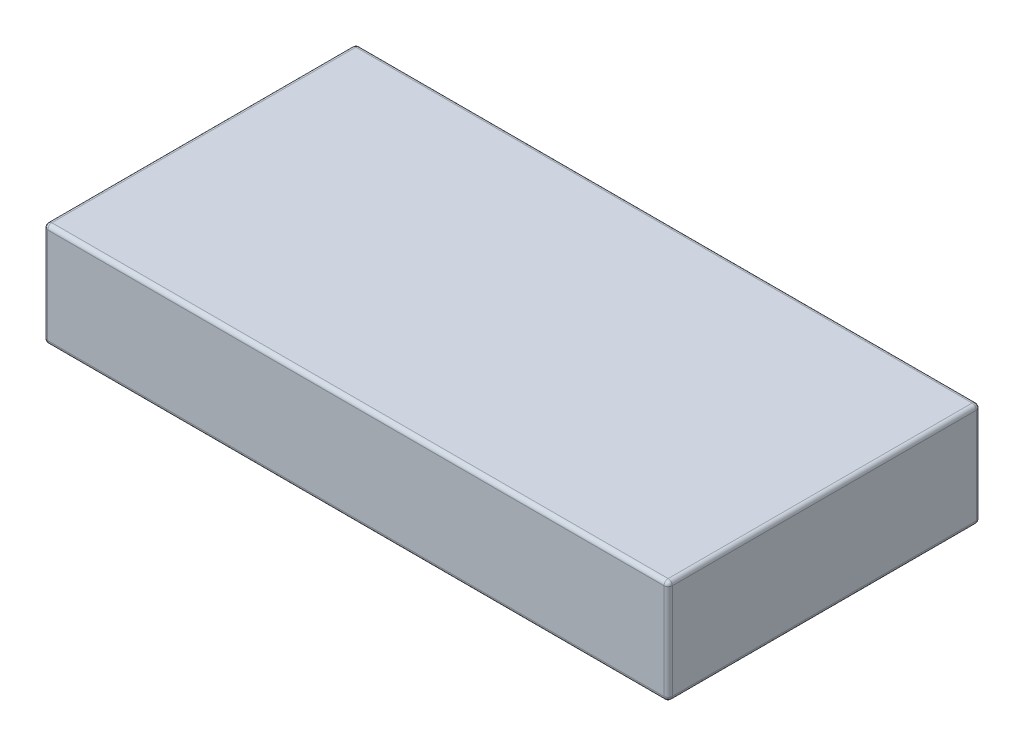
from build123d import *

# Parameters (mm, degrees)
SKETCH_1_W          = 30
SKETCH_1_H          = 15
EXTRUDE_1_DEPTH     = 5
CUT_EXTRUDE_1_DEPTH = 24.45
FILLET_1_R          = 0.2


with BuildPart() as part:
    # 草图1 → 凸台-拉伸1 (new body)
    with BuildSketch(Plane(origin=(0, 0, 0), x_dir=(1, 0, 0), z_dir=(0, 1, 0))):
        Rectangle(SKETCH_1_W, SKETCH_1_H)
    extrude(amount=EXTRUDE_1_DEPTH)

    # 草图2 → 切除-拉伸1 (cut)
    with BuildSketch(Plane.ZY.offset(15)):
        with BuildLine():
            Line((-1.5, 0), (-1.5, 0.677124344))
            ThreePointArc((-1.5, 0.677124344), (-1.780042303, 1.088161527), (-1.95, 1.555590279))
            Line((-1.95, 1.555590279), (-1.95, 2.8))
            Line((-1.95, 2.8), (1.95, 2.8))
            Line((1.95, 2.8), (1.95, 1.555590279))
            ThreePointArc((1.95, 1.555590279), (1.780042303, 1.088161527), (1.5, 0.677124344))
            Line((1.5, 0.677124344), (1.5, 0))
            Line((1.5, 0), (-1.5, 0))
        make_face()
    extrude(amount=-CUT_EXTRUDE_1_DEPTH, mode=Mode.SUBTRACT)

    # 圆角1
    fillet_1_edges = [part.edges().sort_by_distance(p)[0] for p in [
        (15, 5, 0),
        (0, 5, -7.5),
        (-15, 0, 4.5),
        (9.45, 0, 0),
        (-2.775, 0, 1.5),
        (-2.775, 0, -1.5),
        (-15, 5, 0),
        (0, 0, -7.5),
        (15, 0, 0),
        (0, 0, 7.5),
        (-15, 0, -4.5),
        (0, 5, 7.5),
        (-15, 2.5, -7.5),
        (15, 2.5, -7.5),
        (15, 2.5, 7.5),
        (-15, 2.5, 7.5),
    ]]
    fillet(fillet_1_edges, radius=FILLET_1_R)


solid = part.part
